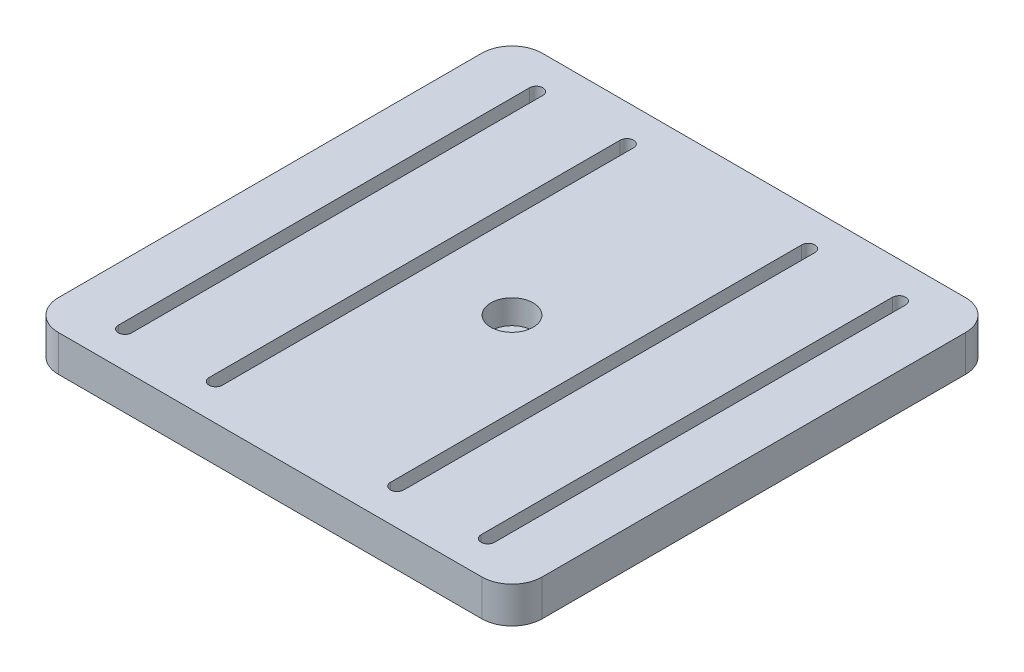
from build123d import *

# Parameters (mm, degrees)
SKETCH1_W            = 80
SKETCH1_H            = 80
BOSS_EXTRUDE1_DEPTH  = 6
CUT_EXTRUDE1_DEPTH   = 57.885850613
CUT_EXTRUDE2_DEPTH   = 1.8
LPATTERN1_COUNT      = 2
LPATTERN1_PITCH      = 15
MIRROR1_COPY_1_DEPTH = 57.885850613
MIRROR1_COPY_2_DEPTH = 1.8
SKETCH5_R            = 3.5
CUT_EXTRUDE3_DEPTH   = 4
SKETCH6_R            = 2.1
CUT_EXTRUDE4_DEPTH   = 57.709787515
FILLET3_R            = 5


with BuildPart() as part:
    # Sketch1 → Boss-Extrude1 (new body)
    with BuildSketch(Plane(origin=(0, 0, 0), x_dir=(1, 0, 0), z_dir=(0, 1, 0))):
        Rectangle(SKETCH1_W, SKETCH1_H)
    extrude(amount=BOSS_EXTRUDE1_DEPTH)

    # Sketch2 → Cut-Extrude1 (cut, through all)
    with BuildSketch(Plane(origin=(0, 6, 0), x_dir=(1, 0, 0), z_dir=(0, 1, 0))):
        with BuildLine():
            Line((16.1, 34), (16.1, -34))
            ThreePointArc((16.1, -34), (15, -35.1), (13.9, -34))
            Line((13.9, -34), (13.9, 34))
            ThreePointArc((13.9, 34), (15, 35.1), (16.1, 34))
        make_face()
    cut_extrude1 = extrude(amount=-CUT_EXTRUDE1_DEPTH, mode=Mode.SUBTRACT)

    # Sketch4 → Cut-Extrude2 (cut)
    with BuildSketch(Plane(origin=(0, 0, 0), x_dir=(1, 0, 0), z_dir=(0, 1, 0))):
        with BuildLine():
            Line((13, 34), (13, -34))
            ThreePointArc((13, -34), (15, -36), (17, -34))
            Line((17, -34), (17, 34))
            ThreePointArc((17, 34), (15, 36), (13, 34))
        make_face()
    cut_extrude2 = extrude(amount=CUT_EXTRUDE2_DEPTH, mode=Mode.SUBTRACT)

    # LPattern1: Cut-Extrude1, Cut-Extrude2 ×2
    with Locations(*[(i * LPATTERN1_PITCH, 0, 0) for i in range(1, LPATTERN1_COUNT)]):
        add(cut_extrude1, mode=Mode.SUBTRACT)
        add(cut_extrude2, mode=Mode.SUBTRACT)

    # Mirror1: Cut-Extrude1, Cut-Extrude2 across plane
    add(cut_extrude1.mirror(Plane(origin=(0, 0, 0), x_dir=(0, 0, 1), z_dir=(1, 0, 0))), mode=Mode.SUBTRACT)
    add(cut_extrude2.mirror(Plane(origin=(0, 0, 0), x_dir=(0, 0, 1), z_dir=(1, 0, 0))), mode=Mode.SUBTRACT)

    # Mirror1 copy 1 sketch → Mirror1 copy 1 (cut, through all)
    with BuildSketch(Plane(origin=(-15, 6, 0), x_dir=(-1, 0, 0), z_dir=(0, 1, 0))):
        with BuildLine():
            Line((16.1, -34), (16.1, 34))
            ThreePointArc((16.1, 34), (15, 35.1), (13.9, 34))
            Line((13.9, 34), (13.9, -34))
            ThreePointArc((13.9, -34), (15, -35.1), (16.1, -34))
        make_face()
    extrude(amount=-MIRROR1_COPY_1_DEPTH, mode=Mode.SUBTRACT)

    # Mirror1 copy 2 sketch → Mirror1 copy 2 (cut)
    with BuildSketch(Plane(origin=(-15, 0, 0), x_dir=(-1, 0, 0), z_dir=(0, 1, 0))):
        with BuildLine():
            Line((13, -34), (13, 34))
            ThreePointArc((13, 34), (15, 36), (17, 34))
            Line((17, 34), (17, -34))
            ThreePointArc((17, -34), (15, -36), (13, -34))
        make_face()
    extrude(amount=MIRROR1_COPY_2_DEPTH, mode=Mode.SUBTRACT)

    # Sketch5 → Cut-Extrude3 (cut)
    with BuildSketch(Plane.XZ.offset(-6)):
        with Locations(Location((0, 0, 0), (0, 0, 270))):
            Circle(SKETCH5_R)
    extrude(amount=CUT_EXTRUDE3_DEPTH, mode=Mode.SUBTRACT)

    # Sketch6 → Cut-Extrude4 (cut, through all)
    with BuildSketch(Plane(origin=(0, 2, 0), x_dir=(1, 0, 0), z_dir=(0, 1, 0))):
        with Locations(Location((0, 0, 0), (0, 0, 270))):
            Circle(SKETCH6_R)
    extrude(amount=-CUT_EXTRUDE4_DEPTH, mode=Mode.SUBTRACT)

    # Fillet3
    fillet3_edges = [part.edges().sort_by_distance(p)[0] for p in [
        (40, 3, 40),
        (-40, 3, 40),
        (-40, 3, -40),
        (40, 3, -40),
    ]]
    fillet(fillet3_edges, radius=FILLET3_R)


solid = part.part
